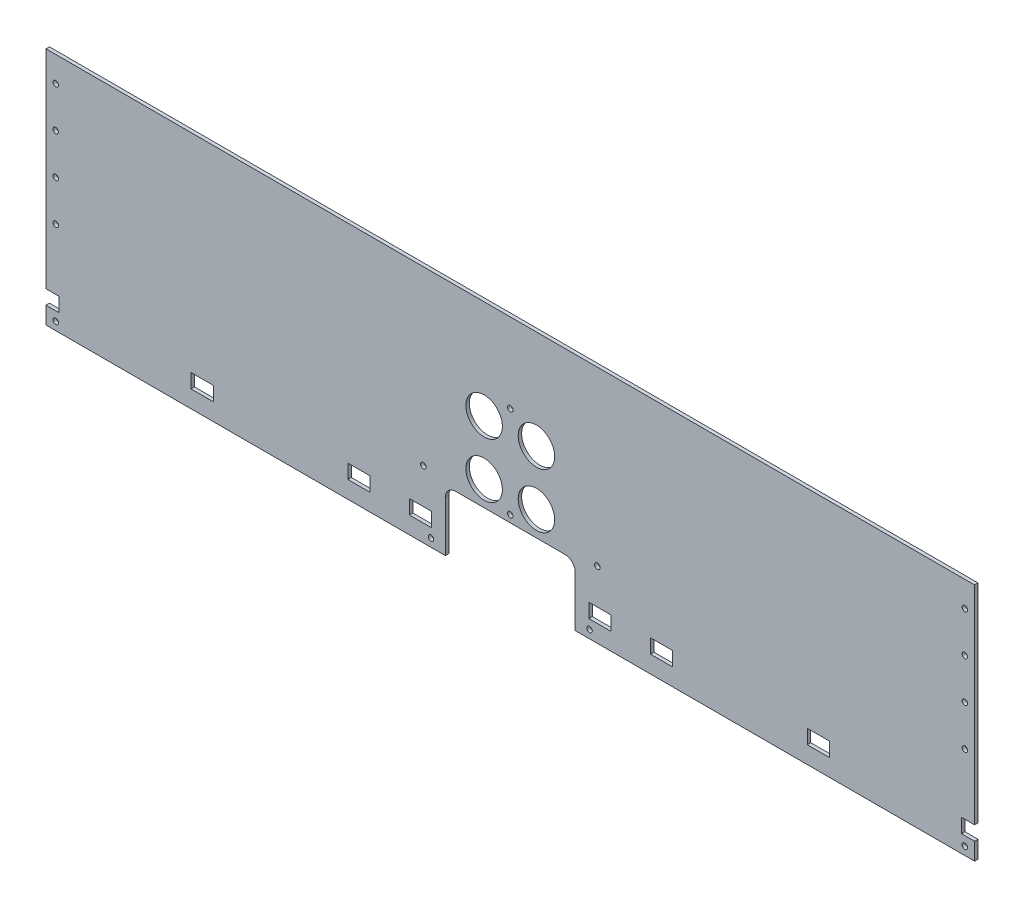
from build123d import *

# Parameters (mm, degrees)
SKETCH3_W           = 458
SKETCH3_H           = 118
BOSS_EXTRUDE2_DEPTH = 1.7
SKETCH4_R           = 1.35
CUT_EXTRUDE1_DEPTH  = 237.484439234
CUT_EXTRUDE2_DEPTH  = 237.484439234
SKETCH6_R           = 9
CUT_EXTRUDE3_DEPTH  = 237.484439234
SKETCH8_W           = 11
SKETCH8_H           = 7
CUT_EXTRUDE4_DEPTH  = 237.484439234


with BuildPart() as part:
    # Sketch3 → Boss-Extrude2 (new body)
    with BuildSketch(Plane.XY):
        Rectangle(SKETCH3_W, SKETCH3_H)
    extrude(amount=BOSS_EXTRUDE2_DEPTH)

    # Sketch4 → Cut-Extrude1 (cut, through all)
    with BuildSketch(Plane.XY.offset(1.7)):
        with Locations((0, 19.8)):
            Circle(SKETCH4_R)
        with Locations((0, -25.5)):
            Circle(SKETCH4_R)
        with Locations((39.1, -55)):
            Circle(SKETCH4_R)
        with Locations((42.9, -26)):
            Circle(SKETCH4_R)
        with Locations((224.2, -55)):
            Circle(SKETCH4_R)
        with Locations(Location((-224.2, -55, 0), (0, 0, 180))):
            Circle(SKETCH4_R)
        with Locations(Location((-42.9, -26, 0), (0, 0, 180))):
            Circle(SKETCH4_R)
        with Locations(Location((-39.1, -55, 0), (0, 0, 180))):
            Circle(SKETCH4_R)
        with Locations((224.2, 46.5)):
            Circle(SKETCH4_R)
        with Locations((224.2, 26.5)):
            Circle(SKETCH4_R)
        with Locations((224.2, 6.5)):
            Circle(SKETCH4_R)
        with Locations((224.2, -13.5)):
            Circle(SKETCH4_R)
        with Locations(Location((-224.2, -13.5, 0), (0, 0, 180))):
            Circle(SKETCH4_R)
        with Locations(Location((-224.2, 6.5, 0), (0, 0, 180))):
            Circle(SKETCH4_R)
        with Locations(Location((-224.2, 26.5, 0), (0, 0, 180))):
            Circle(SKETCH4_R)
        with Locations(Location((-224.2, 46.5, 0), (0, 0, 180))):
            Circle(SKETCH4_R)
    extrude(amount=-CUT_EXTRUDE1_DEPTH, mode=Mode.SUBTRACT)

    # Sketch5 → Cut-Extrude2 (cut, through all)
    with BuildSketch(Plane.XY.offset(1.7)):
        with BuildLine():
            Line((-32, -59), (32, -59))
            Line((32, -59), (32, -34))
            ThreePointArc((32, -34), (30.535533906, -30.464466094), (27, -29))
            Line((27, -29), (-27, -29))
            ThreePointArc((-27, -29), (-30.535533906, -30.464466094), (-32, -34))
            Line((-32, -34), (-32, -59))
        make_face()
    extrude(amount=-CUT_EXTRUDE2_DEPTH, mode=Mode.SUBTRACT)

    # Sketch6 → Cut-Extrude3 (cut, through all)
    with BuildSketch(Plane.XY.offset(1.7)):
        with Locations((-12.9, -16.75)):
            Circle(SKETCH6_R)
        with Locations((-12.9, 10.25)):
            Circle(SKETCH6_R)
        with Locations(Location((12.9, -16.75, 0), (0, 0, 180))):
            Circle(SKETCH6_R)
        with Locations(Location((12.9, 10.25, 0), (0, 0, 180))):
            Circle(SKETCH6_R)
    extrude(amount=-CUT_EXTRUDE3_DEPTH, mode=Mode.SUBTRACT)

    # Sketch8 → Cut-Extrude4 (cut, through all)
    with BuildSketch(Plane.XY.offset(1.7)):
        with Locations((-44.26, -47)):
            Rectangle(SKETCH8_W, SKETCH8_H)
        with Locations((-74.63, -47)):
            Rectangle(SKETCH8_W, SKETCH8_H)
        with Locations((-152, -47)):
            Rectangle(SKETCH8_W, SKETCH8_H)
        with Locations((-228, -47)):
            Rectangle(SKETCH8_W, SKETCH8_H)
        with Locations((228, -47)):
            Rectangle(SKETCH8_W, SKETCH8_H)
        with Locations((152, -47)):
            Rectangle(SKETCH8_W, SKETCH8_H)
        with Locations((74.63, -47)):
            Rectangle(SKETCH8_W, SKETCH8_H)
        with Locations((44.26, -47)):
            Rectangle(SKETCH8_W, SKETCH8_H)
    extrude(amount=-CUT_EXTRUDE4_DEPTH, mode=Mode.SUBTRACT)


solid = part.part
